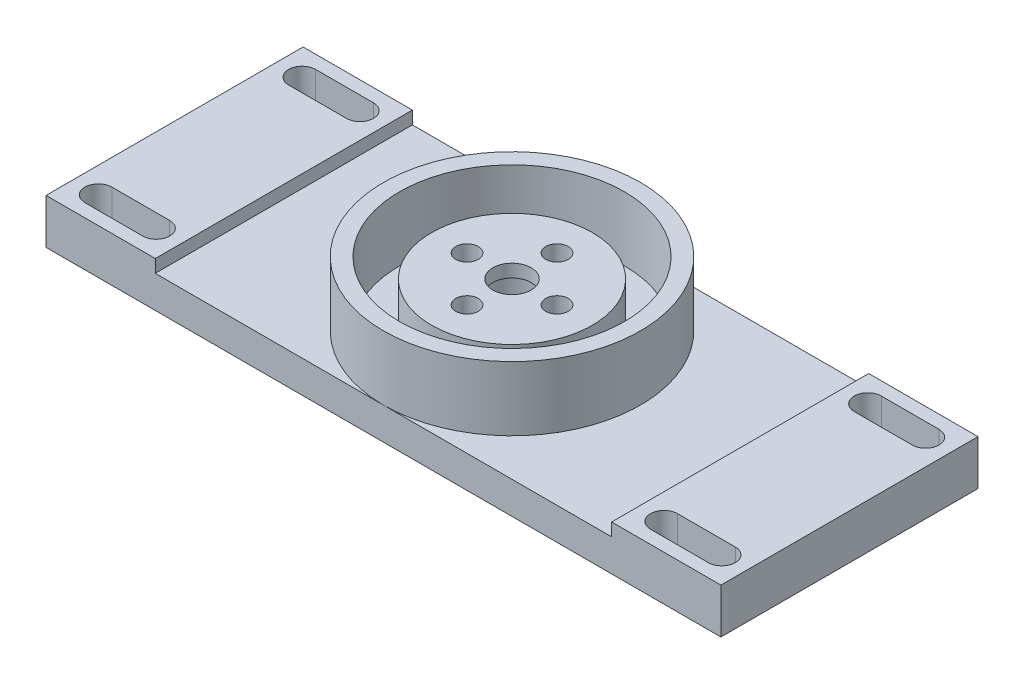
from build123d import *

# Parameters (mm, degrees)
SKETCH1_W           = 105
SKETCH1_H           = 40
BOSS_EXTRUDE1_DEPTH = 7
SKETCH2_W           = 71
SKETCH2_H           = 40
CUT_EXTRUDE1_DEPTH  = 2
SKETCH4_R           = 20
SKETCH4_R_2         = 17.5
SKETCH4_R_3         = 12.5
BOSS_EXTRUDE3_DEPTH = 10
CUT_EXTRUDE2_START  = -3
SKETCH5_R           = 12.5
CUT_EXTRUDE2_DEPTH  = 3
SKETCH6_R           = 3
SKETCH6_R_2         = 1.75
CUT_EXTRUDE3_DEPTH  = 114
SKETCH7_R           = 4.5
CUT_EXTRUDE4_DEPTH  = 10


with BuildPart() as part:
    # Sketch1 → Boss-Extrude1 (new body)
    with BuildSketch(Plane(origin=(0, 0, 0), x_dir=(1, 0, 0), z_dir=(0, 1, 0))):
        with Locations((52.5, 20)):
            Rectangle(SKETCH1_W, SKETCH1_H)
        with BuildLine():
            Line((4, 37.95), (13, 37.95))
            ThreePointArc((13, 37.95), (15.1, 35.85), (13, 33.75))
            Line((13, 33.75), (4, 33.75))
            ThreePointArc((4, 33.75), (1.9, 35.85), (4, 37.95))
        make_face(mode=Mode.SUBTRACT)
        with BuildLine():
            Line((4, 6.25), (13, 6.25))
            ThreePointArc((13, 6.25), (15.1, 4.15), (13, 2.05))
            Line((13, 2.05), (4, 2.05))
            ThreePointArc((4, 2.05), (1.9, 4.15), (4, 6.25))
        make_face(mode=Mode.SUBTRACT)
        with BuildLine():
            Line((92, 37.95), (101, 37.95))
            ThreePointArc((101, 37.95), (103.1, 35.85), (101, 33.75))
            Line((101, 33.75), (92, 33.75))
            ThreePointArc((92, 33.75), (89.9, 35.85), (92, 37.95))
        make_face(mode=Mode.SUBTRACT)
        with BuildLine():
            Line((92, 6.25), (101, 6.25))
            ThreePointArc((101, 6.25), (103.1, 4.15), (101, 2.05))
            Line((101, 2.05), (92, 2.05))
            ThreePointArc((92, 2.05), (89.9, 4.15), (92, 6.25))
        make_face(mode=Mode.SUBTRACT)
    extrude(amount=BOSS_EXTRUDE1_DEPTH)

    # Sketch2 → Cut-Extrude1 (cut)
    with BuildSketch(Plane(origin=(0, 7, 0), x_dir=(1, 0, 0), z_dir=(0, 1, 0))):
        with Locations((52.5, 20)):
            Rectangle(SKETCH2_W, SKETCH2_H)
    extrude(amount=-CUT_EXTRUDE1_DEPTH, mode=Mode.SUBTRACT)

    # Sketch4 → Boss-Extrude3 (add)
    # profile 1 of 2: a face of its own
    with BuildSketch(Plane(origin=(0, 5, 0), x_dir=(1, 0, 0), z_dir=(0, 1, 0))):
        with Locations(Location((52.5, 20, 0), (0, 0, 270))):
            Circle(SKETCH4_R)
        with Locations(Location((52.5, 20, 0), (0, 0, 270))):
            Circle(SKETCH4_R_2, mode=Mode.SUBTRACT)
    # profile 2 of 2: a face of its own
    with BuildSketch(Plane(origin=(0, 5, 0), x_dir=(1, 0, 0), z_dir=(0, 1, 0))):
        with Locations(Location((52.5, 20, 0), (0, 0, 90))):
            Circle(SKETCH4_R_3)
    extrude(amount=BOSS_EXTRUDE3_DEPTH)

    # Sketch5 → Cut-Extrude2 (cut)
    with BuildSketch(Plane(origin=(0, 15, 0), x_dir=(1, 0, 0), z_dir=(0, 1, 0)).offset(CUT_EXTRUDE2_START)):
        with Locations(Location((52.5, 20, 0), (0, 0, 90))):
            Circle(SKETCH5_R)
    extrude(amount=CUT_EXTRUDE2_DEPTH, mode=Mode.SUBTRACT)

    # Sketch6 → Cut-Extrude3 (cut, through all)
    with BuildSketch(Plane(origin=(0, 12, 0), x_dir=(1, 0, 0), z_dir=(0, 1, 0))):
        with Locations(Location((52.5, 20, 0), (0, 0, 270))):
            Circle(SKETCH6_R)
        with Locations(Location((45.5, 20, 0), (0, 0, 270))):
            Circle(SKETCH6_R_2)
        with Locations(Location((52.5, 27, 0), (0, 0, 270))):
            Circle(SKETCH6_R_2)
        with Locations(Location((59.5, 20, 0), (0, 0, 270))):
            Circle(SKETCH6_R_2)
        with Locations(Location((52.5, 13, 0), (0, 0, 270))):
            Circle(SKETCH6_R_2)
    extrude(amount=-CUT_EXTRUDE3_DEPTH, mode=Mode.SUBTRACT)

    # Sketch7 → Cut-Extrude4 (cut)
    with BuildSketch(Plane.XZ):
        with Locations(Location((52.5, -20, 0), (0, 0, 270))):
            Circle(SKETCH7_R)
    extrude(amount=-CUT_EXTRUDE4_DEPTH, mode=Mode.SUBTRACT)


solid = part.part
